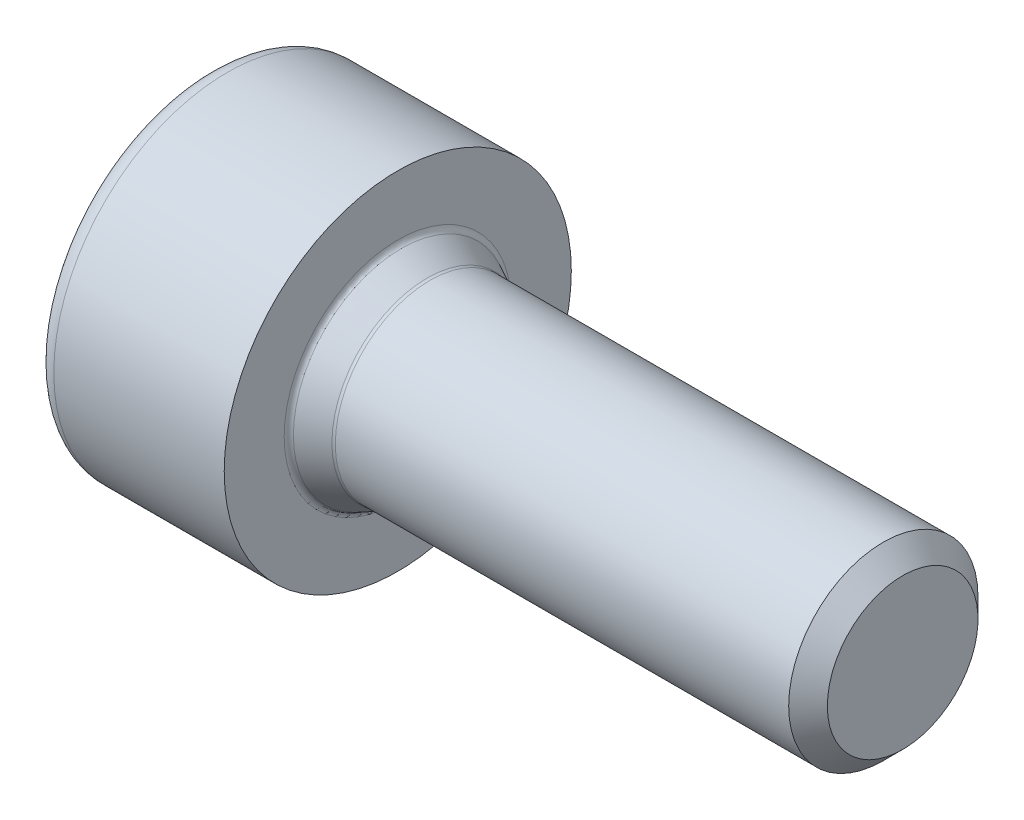
from build123d import *

# Parameters (mm, degrees)
CUT_EXTRUDE1_DEPTH = 2.6


with BuildPart() as part:
    # Sketch1 → Revolve1 (revolve)
    with BuildSketch(Plane.XY, mode=Mode.PRIVATE) as revolve1_sk:
        with BuildLine():
            Line((-0.428312164, 0), (-1.15, 1.25))
            Line((-1.15, 1.25), (-3, 1.25))
            Line((-3, 1.25), (-3, 2.45))
            ThreePointArc((-3, 2.45), (-2.912132034, 2.662132034), (-2.7, 2.75))
            Line((-2.7, 2.75), (0, 2.75))
            Line((0, 2.75), (0, 1.8))
            ThreePointArc((0, 1.8), (0.015193643, 1.74701055), (0.056157637, 1.710123155))
            Line((0.056157637, 1.710123155), (0.466157637, 1.510123155))
            ThreePointArc((0.466157637, 1.510123155), (0.48750205, 1.50256365), (0.51, 1.5))
            Line((0.51, 1.5), (7.6935, 1.5))
            Line((7.6935, 1.5), (8, 1.1935))
            Line((8, 1.1935), (8, 0))
            Line((8, 0), (-0.428312164, 0))
        make_face()
    revolve(revolve1_sk.sketch.rotate(Axis((8, 0, 0), (-1, 0, 0)), 270), axis=Axis((8, 0, 0), (-1, 0, 0)))

    # Sketch2 → Cut-Extrude1 (cut)
    with BuildSketch(Plane(origin=(-1.15, 0, 0), x_dir=(0, 0, -1), z_dir=(1, 0, 0))):
        Polygon((-1.25, 0.721687836), (-1.25, -0.721687836), (0, -1.443375673), (1.25, -0.721687836), (1.25, 0.721687836), (0, 1.443375673), align=None)
    extrude(amount=-CUT_EXTRUDE1_DEPTH, mode=Mode.SUBTRACT)


solid = part.part
